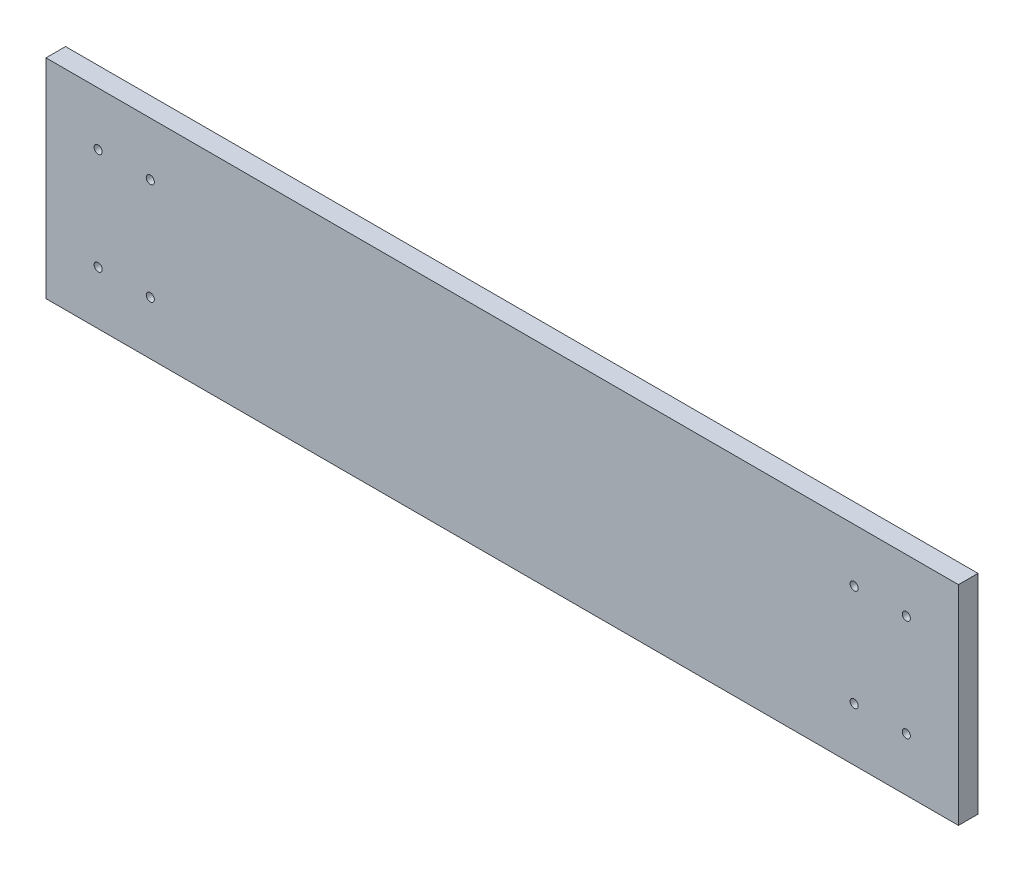
from build123d import *

# Parameters (mm, degrees)
SKETCH1_W               = 889
SKETCH1_H               = 203.2
BOSS_EXTRUDE1_DEPTH     = 19.05
ESQUISSE1_R             = 3.937
ENL_V_MAT_EXTRU_1_DEPTH = 913.126165889


with BuildPart() as part:
    # Sketch1 → Boss-Extrude1 (new body)
    with BuildSketch(Plane.XY):
        with Locations((444.5, 101.6)):
            Rectangle(SKETCH1_W, SKETCH1_H)
    extrude(amount=BOSS_EXTRUDE1_DEPTH)

    # Esquisse1 → Enlèv. mat.-Extru.1 (cut, through all)
    with BuildSketch(Plane(origin=(0, 0, 0), x_dir=(-1, 0, 0), z_dir=(0, 0, -1))):
        with Locations((-838.2, 151.2)):
            Circle(ESQUISSE1_R)
        with Locations((-787.4, 151.2)):
            Circle(ESQUISSE1_R)
        with Locations((-787.4, 52)):
            Circle(ESQUISSE1_R)
        with Locations((-838.2, 52)):
            Circle(ESQUISSE1_R)
        with Locations((-101.6, 151.2)):
            Circle(ESQUISSE1_R)
        with Locations((-50.8, 151.2)):
            Circle(ESQUISSE1_R)
        with Locations((-50.8, 52)):
            Circle(ESQUISSE1_R)
        with Locations((-101.6, 52)):
            Circle(ESQUISSE1_R)
    extrude(amount=-ENL_V_MAT_EXTRU_1_DEPTH, mode=Mode.SUBTRACT)


solid = part.part
